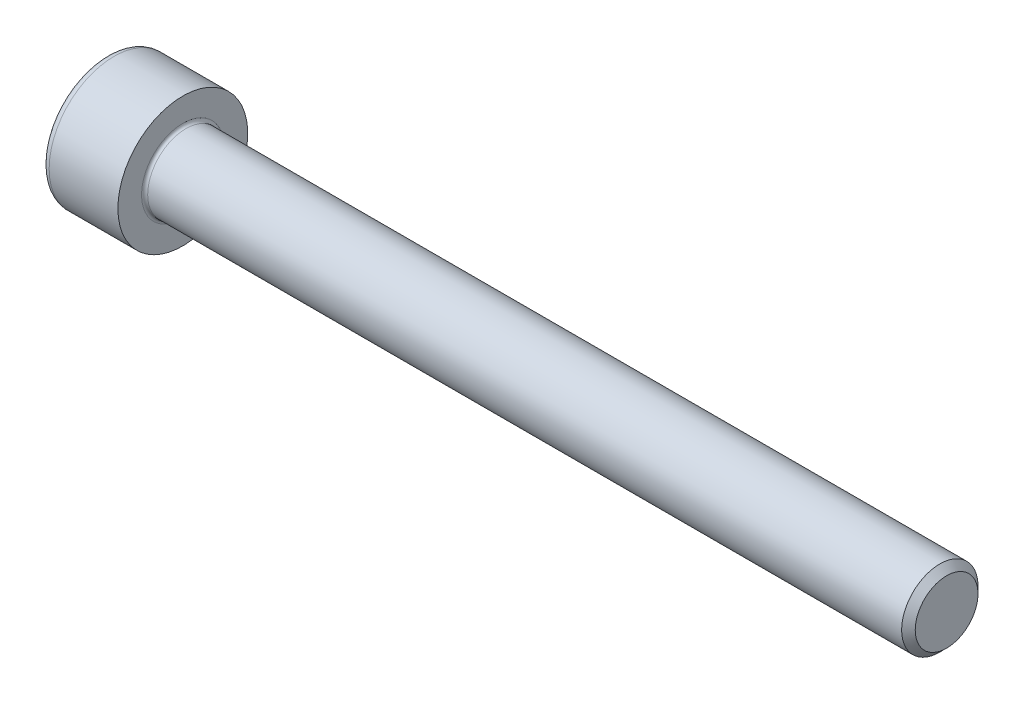
from build123d import *

# Parameters (mm, degrees)
FILLET1_R   = 0.2
FILLET2_R   = 0.5
HEX_2_DEPTH = 2.5


with BuildPart() as part:
    # BodySke → Base-Revolve (revolve)
    with BuildSketch(Plane.XY, mode=Mode.PRIVATE) as base_revolve_sk:
        Polygon((0, 0), (0, 4.25), (5, 4.25), (5, 2.5), (54.555, 2.5), (55, 2.055), (55, 0), align=None)
    revolve(base_revolve_sk.sketch.rotate(Axis((-31.75, 0, 0), (1, 0, 0)), 90), axis=Axis((-31.75, 0, 0), (1, 0, 0)))

    # Fillet1
    fillet1_edges = [part.edges().sort_by_distance(p)[0] for p in [
        (5, 0, -2.5),
    ]]
    fillet(fillet1_edges, radius=FILLET1_R)

    # Fillet2
    fillet2_edges = [part.edges().sort_by_distance(p)[0] for p in [
        (0, 0, -4.25),
    ]]
    fillet(fillet2_edges, radius=FILLET2_R)

    # Sketch2 → Hex-PreBroach (revolve, cut)
    with BuildSketch(Plane.XY, mode=Mode.PRIVATE) as hex_prebroach_sk:
        Polygon((0, 2.01), (2.5, 2.01), (3.660474041, 0), (0, 0), align=None)
    revolve(hex_prebroach_sk.sketch.rotate(Axis((0, 0, 0), (1, 0, 0)), 90), axis=Axis((0, 0, 0), (1, 0, 0)), mode=Mode.SUBTRACT)

    # Sketch3 → Hex 2 (cut)
    with BuildSketch(Plane(origin=(0, 0, 0), x_dir=(0, 0.500000000000001, 0.866025403784438), z_dir=(-1, 0, 0))):
        Polygon((1.160474041, 2.01), (-1.160474041, 2.01), (-2.320948082, 0), (-1.160474041, -2.01), (1.160474041, -2.01), (2.320948082, 0), align=None)
    extrude(amount=-HEX_2_DEPTH, mode=Mode.SUBTRACT)


solid = part.part
